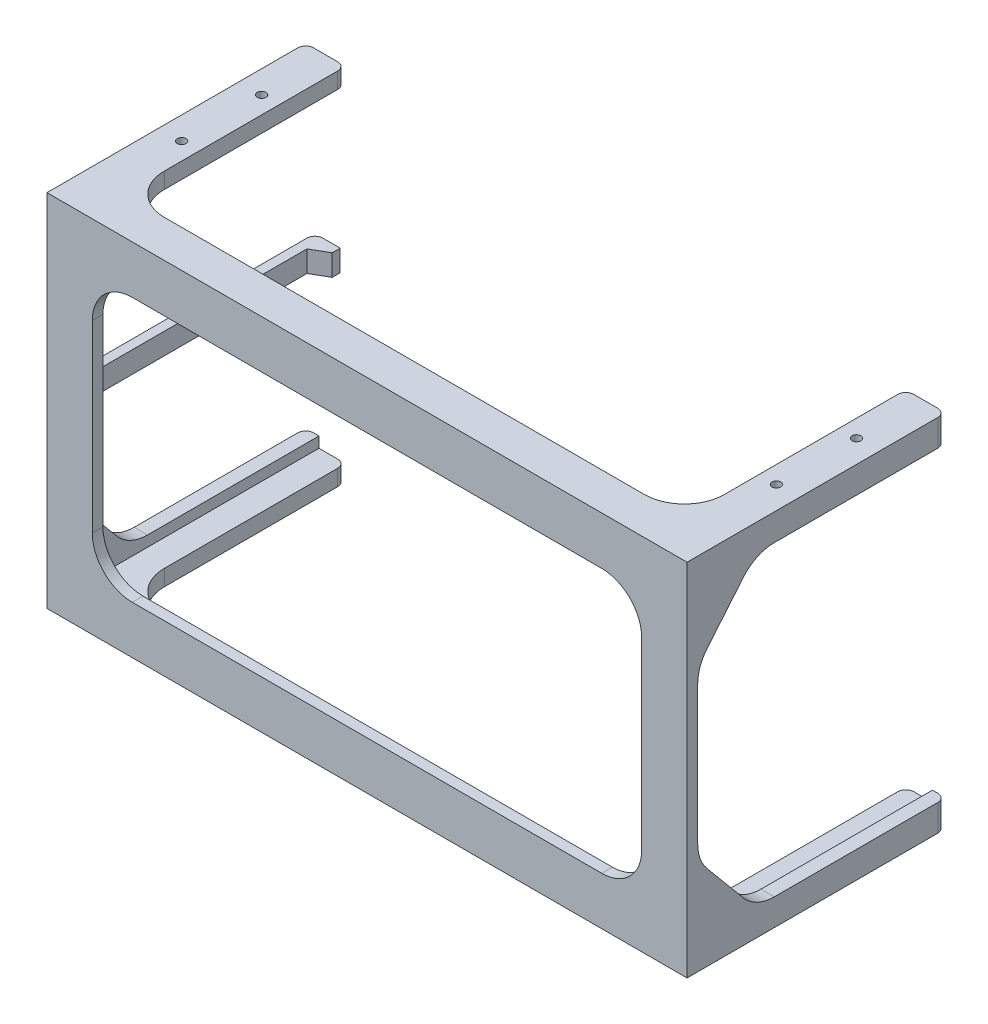
from build123d import *

# Parameters (mm, degrees)
SKETCH1_W                                     = 230
SKETCH1_H                                     = 123
SKETCH1_W_2                                   = 206
SKETCH1_H_2                                   = 99
BOSS_EXTRUDE1_DEPTH                           = 4
SKETCH2_W                                     = 230
SKETCH2_H                                     = 4
BOSS_EXTRUDE2_DEPTH                           = 6
BOSS_EXTRUDE3_DEPTH                           = 5
FILLET1_R                                     = 15
BOSS_EXTRUDE4_DEPTH                           = 4
FILLET2_R                                     = 5
FILLET3_R                                     = 3
CSK_FOR_4_FLAT_HEAD_MACHINE_SCREW1_AT_2_COUNT = 2
CSK_FOR_4_FLAT_HEAD_MACHINE_SCREW1_AT_2_PITCH = 30
CSK_FOR_4_FLAT_HEAD_MACHINE_SCREW1_AT_3_COUNT = 2
CSK_FOR_4_FLAT_HEAD_MACHINE_SCREW1_AT_3_PITCH = 225.008888713
CSK_FOR_4_FLAT_HEAD_MACHINE_SCREW1_AT_4_COUNT = 2
CSK_FOR_4_FLAT_HEAD_MACHINE_SCREW1_AT_4_PITCH = 223


with BuildPart() as part:
    # Sketch1 → Boss-Extrude1 (new body)
    with BuildSketch(Plane.XY):
        Rectangle(SKETCH1_W, SKETCH1_H)
        Rectangle(SKETCH1_W_2, SKETCH1_H_2, mode=Mode.SUBTRACT)
    extrude(amount=BOSS_EXTRUDE1_DEPTH)

    # Sketch2 → Boss-Extrude2 (add)
    with BuildSketch(Plane(origin=(0, 61.5, 0), x_dir=(1, 0, 0), z_dir=(0, 1, 0))):
        Polygon((-115, 10), (-115, 0), (115, 0), (115, 10), (115, 93), (105, 93), (105, 10), (-105, 10), (-105, 93), (-115, 93), align=None)
        with Locations((0, -2)):
            Rectangle(SKETCH2_W, SKETCH2_H)
    boss_extrude2 = extrude(amount=BOSS_EXTRUDE2_DEPTH)

    # Mirror1: Boss-Extrude2 across plane
    add(boss_extrude2.mirror(Plane.ZX))

    # Sketch3 → Boss-Extrude3 (add)
    with BuildSketch(Plane.ZY.offset(115)):
        Polygon((-93, 61.5), (0, 61.5), (0, -61.5), (-93, -61.5), (-93, -67.5), (4, -67.5), (4, 67.5), (-93, 67.5), align=None)
        Polygon((0, 61.5), (-25, 61.5), (-21.666666667, 57.5), (0, 31.5), align=None)
        Polygon((0, -61.5), (0, -31.5), (-21.666666667, -57.5), (-25, -61.5), align=None)
        Polygon((-21.666666667, 57.5), (-25, 61.5), (-93, 61.5), (-93, 57.5), align=None)
        Polygon((-25, -61.5), (-21.666666667, -57.5), (-93, -57.5), (-93, -61.5), align=None)
    boss_extrude3 = extrude(amount=BOSS_EXTRUDE3_DEPTH)

    # Mirror2: Boss-Extrude3 across plane
    add(boss_extrude3.mirror(Plane(origin=(0, 0, 0), x_dir=(0, 0, 1), z_dir=(1, 0, 0))))

    # Fillet1
    fillet1_edges = [part.edges().sort_by_distance(p)[0] for p in [
        (117.5, 57.5, -21.666666667),
        (117.5, -57.5, -21.666666667),
        (117.5, -31.5, 0),
        (117.5, 31.5, 0),
        (-103, -49.5, 2),
        (103, -49.5, 2),
        (103, 49.5, 2),
        (-103, 49.5, 2),
        (105, 64.5, -10),
        (-105, 64.5, -10),
        (-105, -64.5, -10),
        (105, -64.5, -10),
        (-117.5, 57.5, -21.666666667),
        (-117.5, 31.5, 0),
        (-117.5, -31.5, 0),
        (-117.5, -57.5, -21.666666667),
    ]]
    fillet(fillet1_edges, radius=FILLET1_R)

    # Sketch4 → Boss-Extrude4 (add, symmetric)
    with BuildSketch(Plane(origin=(0, 0, 0), x_dir=(1, 0, 0), z_dir=(0, 1, 0))):
        Polygon((-120, 96.464101615), (-120, 0), (-116.5, 0), (-116.5, 90), (-110.5, 93.464101615), (-110.5, 96.464101615), align=None)
    extrude(amount=BOSS_EXTRUDE4_DEPTH, both=True)

    # Fillet2
    fillet2_edges = [part.edges().sort_by_distance(p)[0] for p in [
        (-118.25, 4, 0),
        (-118.25, -4, 0),
    ]]
    fillet(fillet2_edges, radius=FILLET2_R)

    # Fillet3
    fillet3_edges = [part.edges().sort_by_distance(p)[0] for p in [
        (120, 62.5, -93),
        (120, -62.5, -93),
        (105, 64.5, -93),
        (-120, 0, -96.464101615),
        (-105, 64.5, -93),
        (-105, -64.5, -93),
        (105, -64.5, -93),
        (-120, -62.5, -93),
        (-120, 62.5, -93),
    ]]
    fillet(fillet3_edges, radius=FILLET3_R)

    # Sketch6 → CSK for #4 Flat Head Machine Screw1 (revolve, cut)
    with BuildSketch(Plane(origin=(111.5, 61.5, -68), x_dir=(0, 0, -1), z_dir=(1, 0, 0))):
        Polygon((0, 0), (0, 6), (1.63195, 6), (1.63195, 2.409835609), (2.857501397, 1), (2.857501397, 0), align=None)
    csk_for_4_flat_head_machine_screw1 = revolve(axis=Axis((111.5, 55.15, -68), (0, 1, 0)), mode=Mode.SUBTRACT)

    # CSK for #4 Flat Head Machine Screw1 at 2: CSK for #4 Flat Head Machine Screw1 ×2
    with Locations(*[(0, 0, i * CSK_FOR_4_FLAT_HEAD_MACHINE_SCREW1_AT_2_PITCH) for i in range(1, CSK_FOR_4_FLAT_HEAD_MACHINE_SCREW1_AT_2_COUNT)]):
        add(csk_for_4_flat_head_machine_screw1, mode=Mode.SUBTRACT)

    # CSK for #4 Flat Head Machine Screw1 at 3: CSK for #4 Flat Head Machine Screw1 ×2
    with Locations(*[Vector(-0.9910719584243963, 0, 0.13332806615574816) * (i * CSK_FOR_4_FLAT_HEAD_MACHINE_SCREW1_AT_3_PITCH) for i in range(1, CSK_FOR_4_FLAT_HEAD_MACHINE_SCREW1_AT_3_COUNT)]):
        add(csk_for_4_flat_head_machine_screw1, mode=Mode.SUBTRACT)

    # CSK for #4 Flat Head Machine Screw1 at 4: CSK for #4 Flat Head Machine Screw1 ×2
    with Locations(*[(-i * CSK_FOR_4_FLAT_HEAD_MACHINE_SCREW1_AT_4_PITCH, 0, 0) for i in range(1, CSK_FOR_4_FLAT_HEAD_MACHINE_SCREW1_AT_4_COUNT)]):
        add(csk_for_4_flat_head_machine_screw1, mode=Mode.SUBTRACT)


solid = part.part
